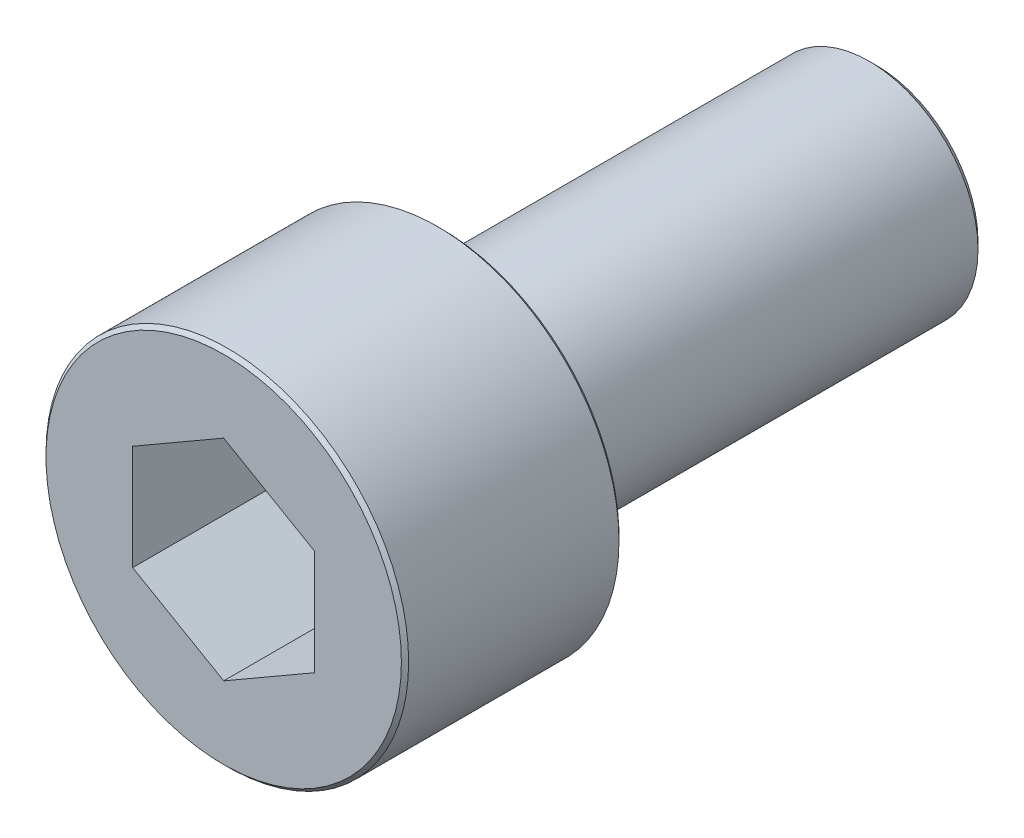
from build123d import *

# Parameters (mm, degrees)
SKETCH_1_W          = 5
SKETCH_1_H          = 6
SKETCH_2_R          = 3
EXTRUDE_1_DEPTH     = 12
CUT_EXTRUDE_1_DEPTH = 4.5
CHAMFER_1_SIZE2     = 0.099999313
CHAMFER_1_SIZE      = 0.099999361
CHAMFER_2_SIZE      = 0.200001286
CHAMFER_2_SIZE2     = 0.200001378


with BuildPart() as part:
    # 草图1 → 旋转1 (revolve)
    with BuildSketch(Plane(origin=(0, 0, 0), x_dir=(1, 0, 0), z_dir=(0, 1, 0))):
        with Locations((2.5, -15)):
            Rectangle(SKETCH_1_W, SKETCH_1_H)
    revolve(axis=Axis((0, 0, 12), (0, 0, 1)))

    # 草图2 → 凸台-拉伸1 (add)
    with BuildSketch(Plane(origin=(0, 0, 12), x_dir=(-1, 0, 0), z_dir=(0, 0, -1))):
        Circle(SKETCH_2_R)
    extrude(amount=EXTRUDE_1_DEPTH)

    # 草图3 → 切除-拉伸1 (cut)
    with BuildSketch(Plane.XY.offset(18)):
        Polygon((-2.51, -1.449149176), (0, -2.898298351), (2.51, -1.449149176), (2.51, 1.449149176), (0, 2.898298351), (-2.51, 1.449149176), align=None)
    extrude(amount=-CUT_EXTRUDE_1_DEPTH, mode=Mode.SUBTRACT)

    # 倒角1
    chamfer_1_edges = [part.edges().sort_by_distance(p)[0] for p in [
        (-5, 0, 18),
        (-5, 0, 12),
    ]]
    chamfer(chamfer_1_edges, length=CHAMFER_1_SIZE, length2=CHAMFER_1_SIZE2)

    # 倒角2
    chamfer_2_edges = [part.edges().sort_by_distance(p)[0] for p in [
        (3, 0, 0),
    ]]
    chamfer_2_side = [part.faces().sort_by_distance(p)[0] for p in [
        (3, 0, 6),
    ]]
    chamfer(chamfer_2_edges, length=CHAMFER_2_SIZE, length2=CHAMFER_2_SIZE2, reference=chamfer_2_side[0])


solid = part.part
